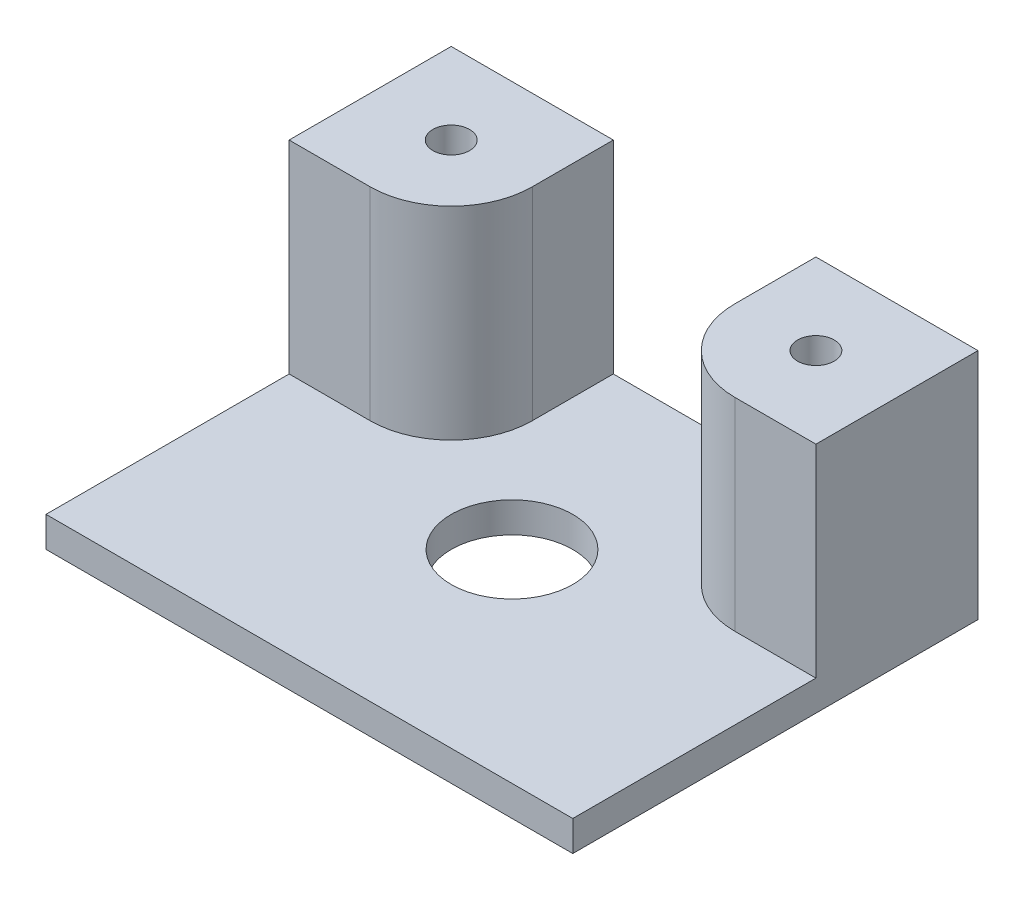
from build123d import *

# Parameters (mm, degrees)
SKETCH1_W              = 165.1
SKETCH1_H              = 127
BASE_EXTRUDE_DEPTH     = 9.525
SKETCH2_R              = 19.05
CENTER_HOLE_DEPTH      = 105.582398734
SKETCH3_W              = 50.8
SKETCH3_H              = 50.8
TOWER_EXTRUDE_DEPTH    = 63.5
FILLET_2_R             = 25.4
FILLET_2_OF_MIRROR_2_R = 25.4


with BuildPart() as part:
    # Sketch1 → Base Extrude (new body)
    with BuildSketch(Plane(origin=(0, 0, 0), x_dir=(1, 0, 0), z_dir=(0, 1, 0))):
        Rectangle(SKETCH1_W, SKETCH1_H)
    extrude(amount=BASE_EXTRUDE_DEPTH)

    # Sketch2 → Center Hole (cut, through all)
    with BuildSketch(Plane(origin=(0, 9.525, 0), x_dir=(1, 0, 0), z_dir=(0, 1, 0))):
        with Locations(Location((0, 0, 0), (0, 0, 270))):
            Circle(SKETCH2_R)
    extrude(amount=-CENTER_HOLE_DEPTH, mode=Mode.SUBTRACT)

    # Sketch3 → Tower Extrude (add)
    with BuildSketch(Plane(origin=(0, 9.525, 0), x_dir=(1, 0, 0), z_dir=(0, 1, 0))):
        with Locations((-57.15, 38.1)):
            Rectangle(SKETCH3_W, SKETCH3_H)
    tower_extrude = extrude(amount=TOWER_EXTRUDE_DEPTH)

    # Fillet 2
    fillet_2_edges = [part.edges().sort_by_distance(p)[0] for p in [
        (-31.75, 41.275, -12.7),
    ]]
    fillet(fillet_2_edges, radius=FILLET_2_R)

    # Sketch7 → 1/2-20 Tapped Hole (revolve, cut)
    with BuildSketch(Plane(origin=(-57.15, 73.025, -38.1), x_dir=(0, 0, 1), z_dir=(1, 0, 0))):
        Polygon((0, 0), (0, 35.20757432), (5.75437, 31.75), (5.75437, 0), align=None)
    f_1_2_20_tapped_hole = revolve(axis=Axis((-57.15, 79.375, -38.1), (0, -1, 0)), mode=Mode.SUBTRACT)

    # Mirror 2: Tower Extrude, 1/2-20 Tapped Hole across plane
    add(tower_extrude.mirror(Plane(origin=(0, 0, 0), x_dir=(0, 0, 1), z_dir=(1, 0, 0))))
    add(f_1_2_20_tapped_hole.mirror(Plane(origin=(0, 0, 0), x_dir=(0, 0, 1), z_dir=(1, 0, 0))), mode=Mode.SUBTRACT)

    # Fillet 2 of Mirror 2
    fillet_2_of_mirror_2_edges = [part.edges().sort_by_distance(p)[0] for p in [
        (31.75, 41.275, -12.7),
    ]]
    fillet(fillet_2_of_mirror_2_edges, radius=FILLET_2_OF_MIRROR_2_R)


solid = part.part
